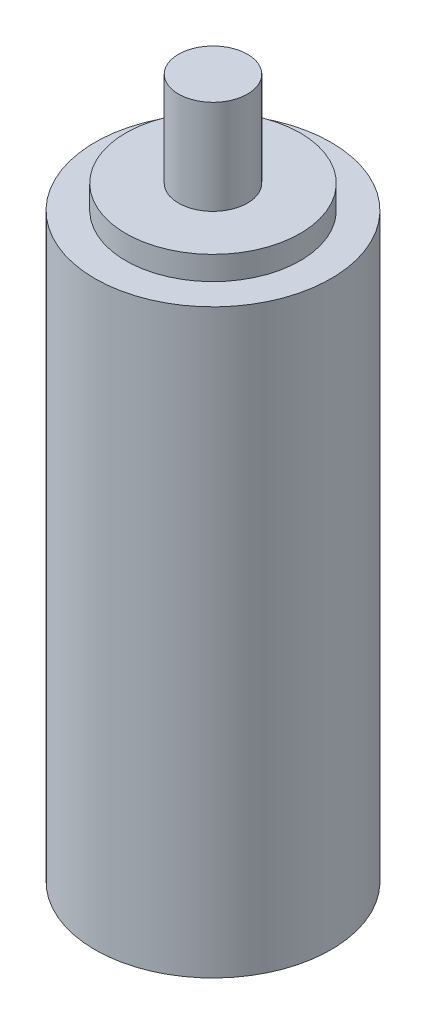
from build123d import *

# Parameters (mm, degrees)
SKETCH1_R           = 32.5
BOSS_EXTRUDE1_DEPTH = 160
SKETCH2_R           = 24
BOSS_EXTRUDE2_DEPTH = 6.5
SKETCH3_R           = 9.5
BOSS_EXTRUDE3_DEPTH = 26


with BuildPart() as part:
    # Sketch1 → Boss-Extrude1 (new body)
    with BuildSketch(Plane(origin=(0, 0, 0), x_dir=(1, 0, 0), z_dir=(0, 1, 0))):
        with Locations(Location((0, 0, 0), (0, 0, 270))):
            Circle(SKETCH1_R)
    extrude(amount=BOSS_EXTRUDE1_DEPTH)

    # Sketch2 → Boss-Extrude2 (add)
    with BuildSketch(Plane(origin=(0, 160, 0), x_dir=(1, 0, 0), z_dir=(0, 1, 0))):
        with Locations(Location((0, 0, 0), (0, 0, 90))):
            Circle(SKETCH2_R)
    extrude(amount=BOSS_EXTRUDE2_DEPTH)

    # Sketch3 → Boss-Extrude3 (add)
    with BuildSketch(Plane(origin=(0, 166.5, 0), x_dir=(1, 0, 0), z_dir=(0, 1, 0))):
        with Locations(Location((0, 0, 0), (0, 0, 90))):
            Circle(SKETCH3_R)
    extrude(amount=BOSS_EXTRUDE3_DEPTH)


solid = part.part
